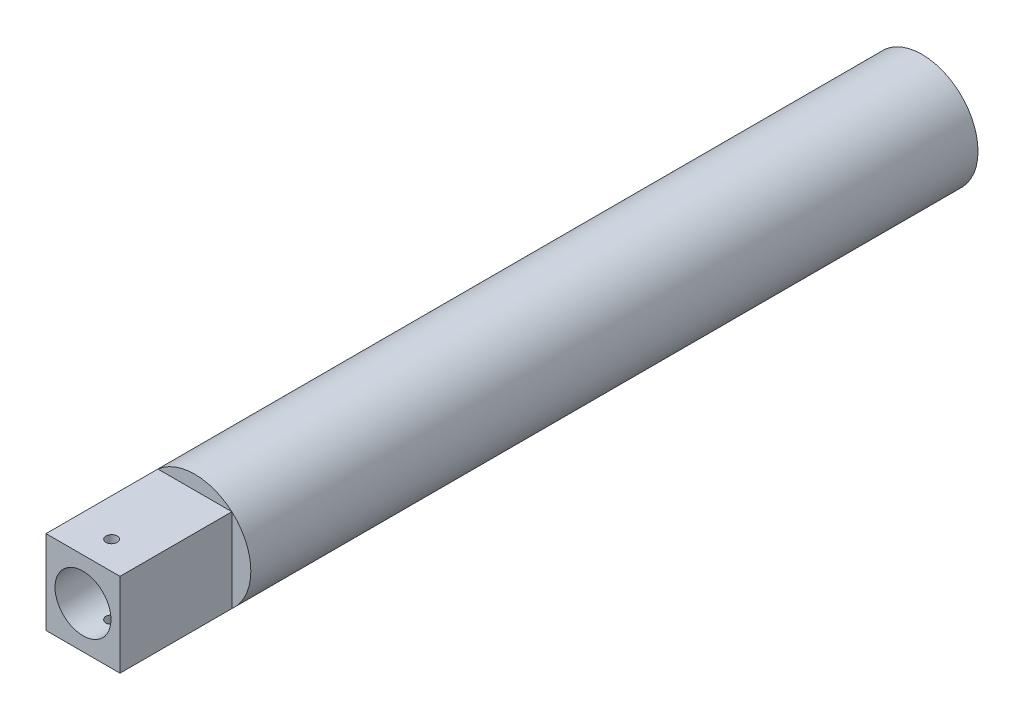
from build123d import *

# Parameters (mm, degrees)
SKETCH1_R           = 10
BOSS_EXTRUDE1_DEPTH = 150
CUT_EXTRUDE1_START  = -20
CUT_EXTRUDE1_DEPTH  = 20
SKETCH3_3_R         = 1
CUT_EXTRUDE4_DEPTH  = 152.348108677
SKETCH7_R           = 1
CUT_EXTRUDE5_DEPTH  = 10
SKETCH8_R           = 5
CUT_EXTRUDE6_DEPTH  = 151.665191733


with BuildPart() as part:
    # Sketch1 → Boss-Extrude1 (new body)
    with BuildSketch(Plane.XY):
        Circle(SKETCH1_R)
    extrude(amount=BOSS_EXTRUDE1_DEPTH)

    # Sketch2 → Cut-Extrude1 (cut)
    with BuildSketch(Plane.XY.offset(150).offset(CUT_EXTRUDE1_START)):
        with BuildLine():
            ThreePointArc((6.614378278, 7.5), (0, 10), (-6.614378278, 7.5))
            Line((-6.614378278, 7.5), (6.614378278, 7.5))
        make_face()
        with BuildLine():
            Line((-6.614378278, -7.5), (-6.614378278, 7.5))
            ThreePointArc((-6.614378278, 7.5), (-10, 0), (-6.614378278, -7.5))
        make_face()
        with BuildLine():
            ThreePointArc((6.614378278, -7.5), (10, 0), (6.614378278, 7.5))
            Line((6.614378278, 7.5), (6.614378278, -7.5))
        make_face()
        with BuildLine():
            Line((6.614378278, -7.5), (-6.614378278, -7.5))
            ThreePointArc((-6.614378278, -7.5), (0, -10), (6.614378278, -7.5))
        make_face()
    extrude(amount=CUT_EXTRUDE1_DEPTH, mode=Mode.SUBTRACT)

    # Sketch3<3> → Cut-Extrude4 (cut, through all)
    with BuildSketch(Plane(origin=(0, 7.5, 0), x_dir=(1, 0, 0), z_dir=(0, 1, 0))):
        with Locations((0.114378278, -145)):
            Circle(SKETCH3_3_R)
    extrude(amount=-CUT_EXTRUDE4_DEPTH, mode=Mode.SUBTRACT)

    # Sketch7 → Cut-Extrude5 (cut)
    with BuildSketch(Plane(origin=(0, 0, 0), x_dir=(-1, 0, 0), z_dir=(0, 0, -1))):
        with Locations((7.5, 0)):
            Circle(SKETCH7_R)
        with Locations((-7.5, 0)):
            Circle(SKETCH7_R)
    extrude(amount=-CUT_EXTRUDE5_DEPTH, mode=Mode.SUBTRACT)

    # Sketch8 → Cut-Extrude6 (cut, through all)
    with BuildSketch(Plane(origin=(0, 0, 0), x_dir=(-1, 0, 0), z_dir=(0, 0, -1))):
        Circle(SKETCH8_R)
    extrude(amount=-CUT_EXTRUDE6_DEPTH, mode=Mode.SUBTRACT)


solid = part.part
